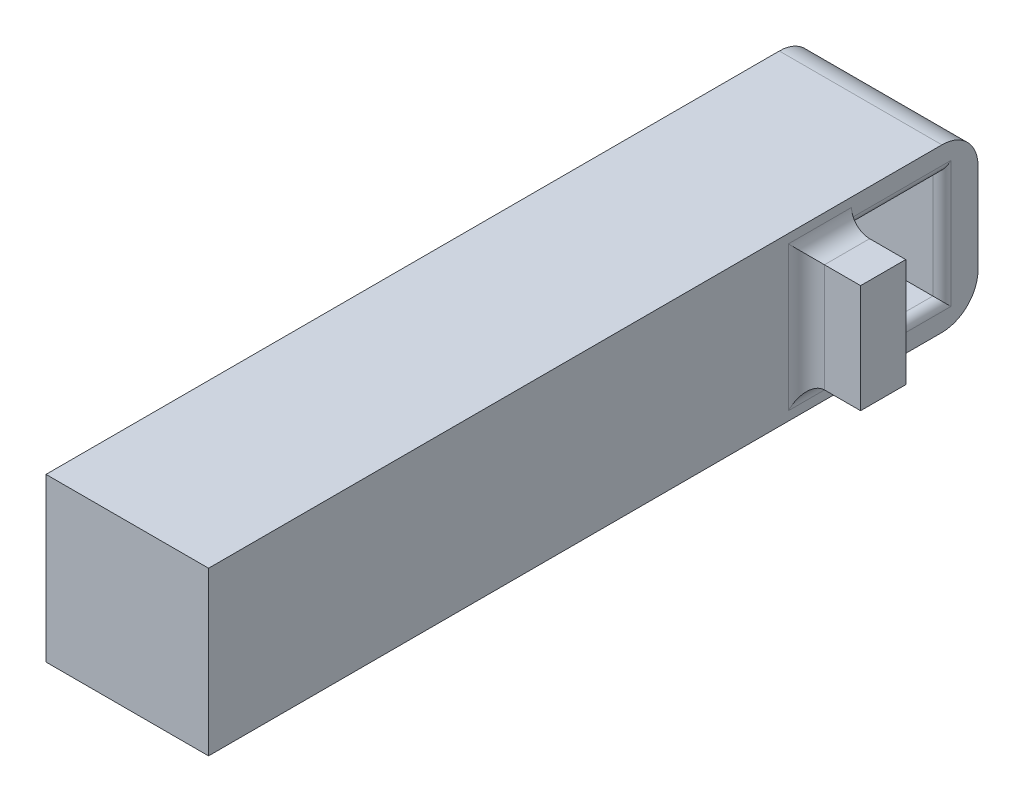
from build123d import *

# Parameters (mm, degrees)
SKETCH1_W           = 85.2
SKETCH1_H           = 18
SKETCH1_W_2         = 10
SKETCH1_H_2         = 12
BOSS_EXTRUDE1_DEPTH = 9
SKETCH2_W           = 5
SKETCH2_H           = 12
BOSS_EXTRUDE2_DEPTH = 6
FILLET1_R           = 2
FILLET2_R           = 1
FILLET3_R           = 4


with BuildPart() as part:
    # Sketch1 → Boss-Extrude1 (new, symmetric)
    with BuildSketch(Plane(origin=(0, 0, 0), x_dir=(0, 0, -1), z_dir=(1, 0, 0))):
        with Locations((42.6, 9)):
            Rectangle(SKETCH1_W, SKETCH1_H)
        with Locations((76.2, 9)):
            Rectangle(SKETCH1_W_2, SKETCH1_H_2, mode=Mode.SUBTRACT)
    extrude(amount=BOSS_EXTRUDE1_DEPTH, both=True)

    # Sketch2 → Boss-Extrude2 (add)
    with BuildSketch(Plane(origin=(9, 0, 0), x_dir=(0, 0, -1), z_dir=(1, 0, 0))):
        with Locations((68.7, 9)):
            Rectangle(SKETCH2_W, SKETCH2_H)
    extrude(amount=BOSS_EXTRUDE2_DEPTH)

    # Fillet1
    fillet1_edges = [part.edges().sort_by_distance(p)[0] for p in [
        (9, 15, -68.7),
        (9, 9, -66.2),
        (9, 3, -68.7),
    ]]
    fillet(fillet1_edges, radius=FILLET1_R)

    # Fillet2
    fillet2_edges = [part.edges().sort_by_distance(p)[0] for p in [
        (9, 9, -81.2),
        (9, 15, -76.2),
        (9, 3, -76.2),
    ]]
    fillet(fillet2_edges, radius=FILLET2_R)

    # Fillet3
    fillet3_edges = [part.edges().sort_by_distance(p)[0] for p in [
        (0, 18, -85.2),
        (0, 0, -85.2),
    ]]
    fillet(fillet3_edges, radius=FILLET3_R)


solid = part.part
